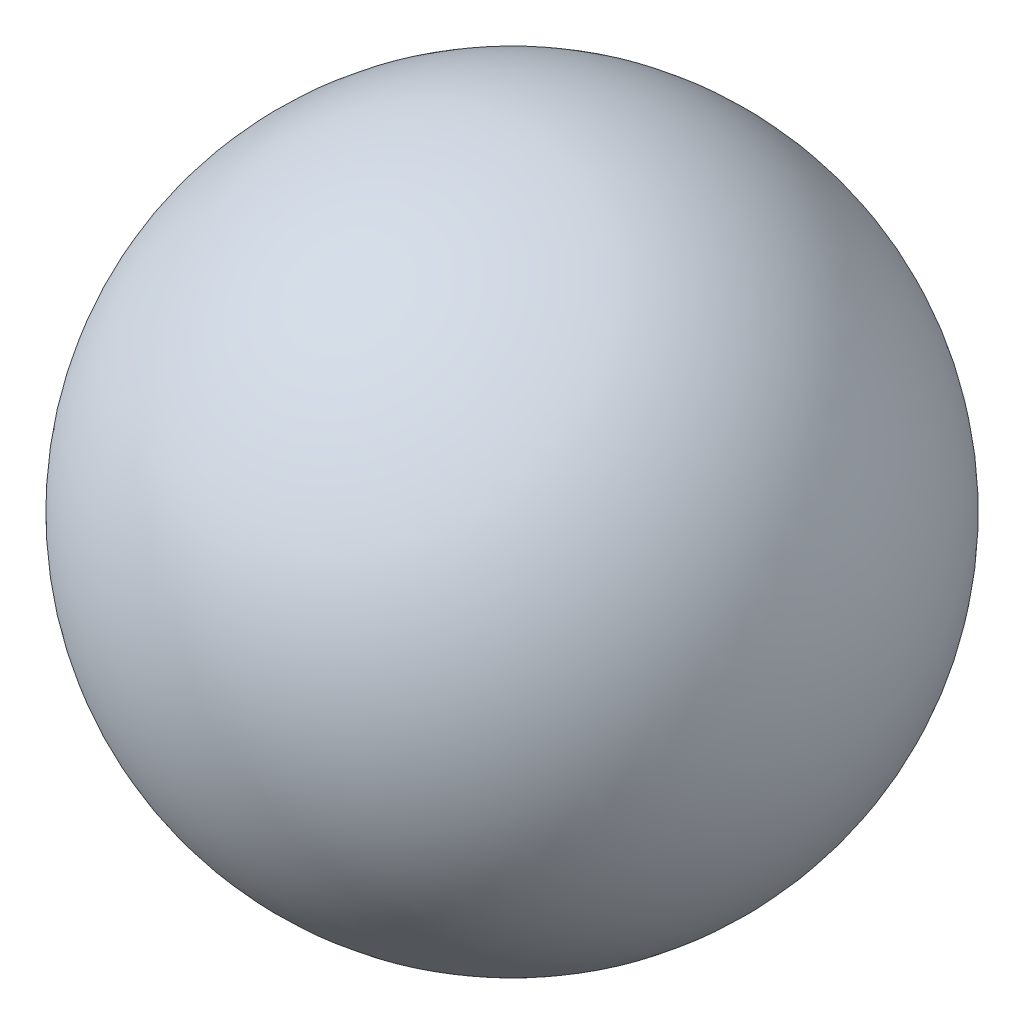
from build123d import *


with BuildPart() as part:
    # Sketch2 → Revolve1 (revolve)
    with BuildSketch(Plane.XY):
        with BuildLine():
            Line((0, 20), (0, 19.475))
            ThreePointArc((0, 19.475), (19.475, 0), (0, -19.475))
            Line((0, -19.475), (0, -20))
            ThreePointArc((0, -20), (20, 0), (0, 20))
        make_face()
    revolve(axis=Axis((0, 20, 0), (0, -1, 0)))


solid = part.part
